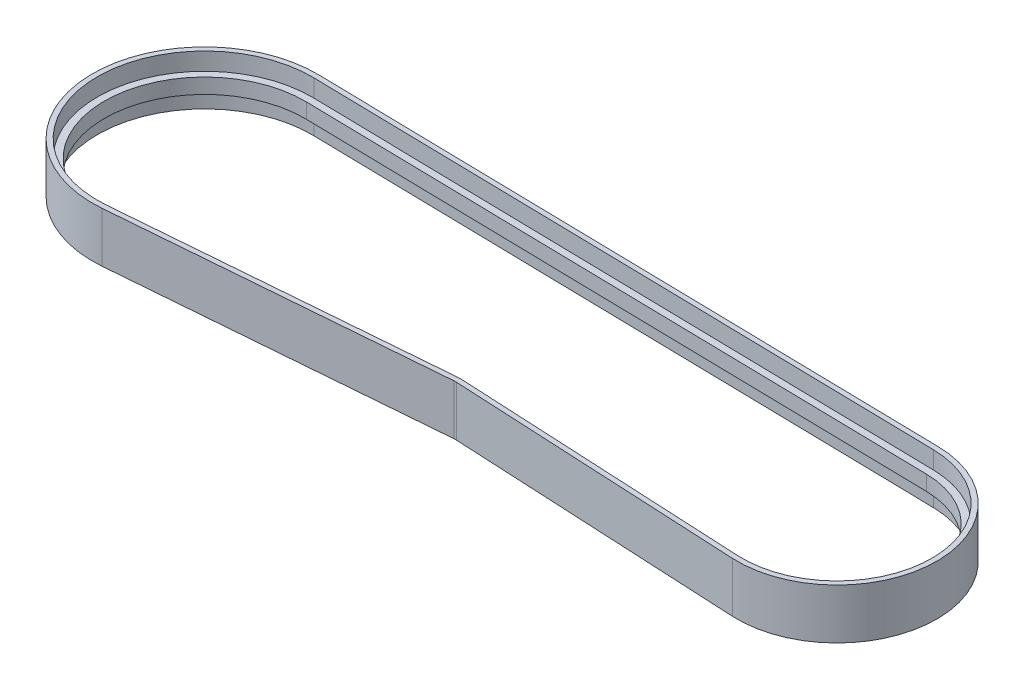
from build123d import *

# Parameters (mm, degrees)
BOSS_EXTRUDE1_DEPTH = 5
BOSS_EXTRUDE2_DEPTH = 1.5


with BuildPart() as part:
    # Sketch1 → Boss-Extrude1 (new, symmetric)
    with BuildSketch(Plane(origin=(0, 0, 0), x_dir=(1, 0, 0), z_dir=(0, 1, 0))):
        with BuildLine():
            Line((0.434583333, 22.345774485), (126.386944444, 19.896237684))
            ThreePointArc((126.386944444, 19.896237684), (145.888566517, -0.674478997), (125.038127363, -19.876740201))
            Line((125.038127363, -19.876740201), (67.116731829, -16.970417062))
            ThreePointArc((67.116731829, -16.970417062), (66.886386328, -16.966450661), (66.65627889, -16.977646615))
            Line((66.65627889, -16.977646615), (1.820273578, -22.275751482))
            ThreePointArc((1.820273578, -22.275751482), (-22.339230959, -0.693729175), (0.434583333, 22.345774485))
        make_face()
        with BuildLine():
            Line((0.415138889, 21.345963546), (126.3675, 18.896426746))
            ThreePointArc((126.3675, 18.896426746), (144.88856319, -0.657404457), (125.052845875, -18.876252252))
            Line((125.052845875, -18.876252252), (67.150013324, -15.970860547))
            ThreePointArc((67.150013324, -15.970860547), (66.862262413, -15.966714067), (66.574834882, -15.980968697))
            Line((66.574834882, -15.980968697), (1.73882957, -21.279073564))
            ThreePointArc((1.73882957, -21.279073564), (-21.339712795, -0.662689838), (0.415138889, 21.345963546))
        make_face(mode=Mode.SUBTRACT)
    extrude(amount=BOSS_EXTRUDE1_DEPTH, both=True)

    # Sketch8 → Boss-Extrude2 (add, symmetric)
    with BuildSketch(Plane(origin=(0, 0, 0), x_dir=(1, 0, 0), z_dir=(0, 1, 0))):
        with BuildLine():
            Line((67.1403688, -16.170628229), (125.04282308, -19.076000953))
            ThreePointArc((125.04282308, -19.076000953), (145.088442165, -0.664361118), (126.371388889, 19.096388933))
            Line((126.371388889, 19.096388933), (0.419027778, 21.545925734))
            ThreePointArc((0.419027778, 21.545925734), (-21.539616428, -0.668897706), (1.755118371, -21.478409147))
            Line((1.755118371, -21.478409147), (66.591123683, -16.18030428))
            ThreePointArc((66.591123683, -16.18030428), (66.865591568, -16.166686447), (67.1403688, -16.170628229))
        make_face()
        with BuildLine():
            Line((67.217731767, -14.572497151), (125.12300544, -17.478011344))
            ThreePointArc((125.12300544, -17.478011344), (143.489410361, -0.60870783), (126.340277778, 17.496691431))
            Line((126.340277778, 17.496691431), (0.387916667, 19.946228231))
            ThreePointArc((0.387916667, 19.946228231), (-19.940387366, -0.619234767), (1.624807959, -19.883724478))
            Line((1.624807959, -19.883724478), (66.460813271, -14.58561961))
            ThreePointArc((66.460813271, -14.58561961), (66.839061833, -14.566905785), (67.217731767, -14.572497151))
        make_face(mode=Mode.SUBTRACT)
    extrude(amount=BOSS_EXTRUDE2_DEPTH, both=True)


solid = part.part
